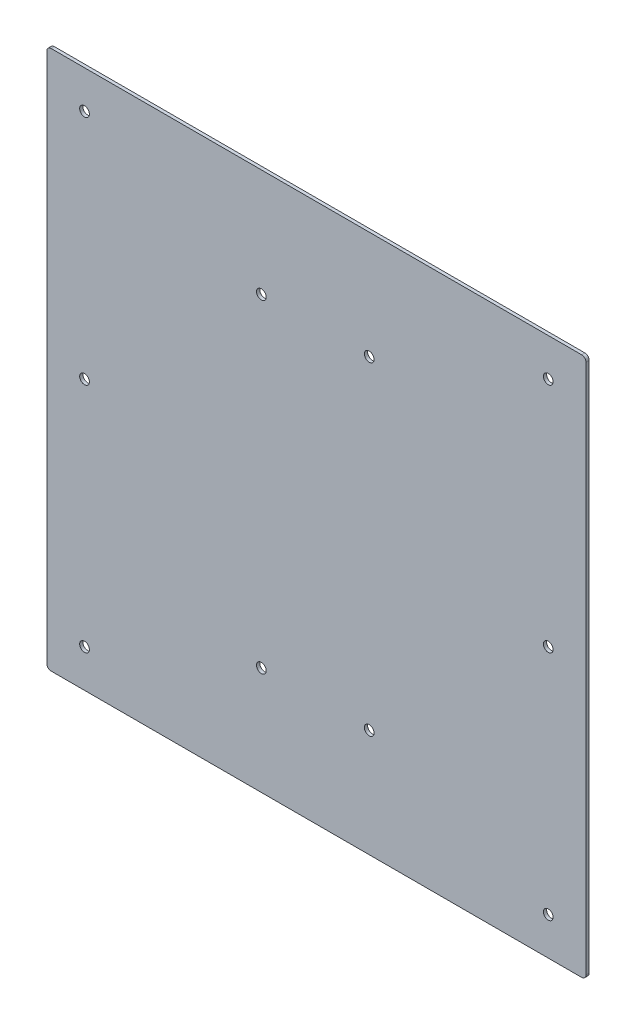
from build123d import *

# Parameters (mm, degrees)
SKETCH1_W           = 250
SKETCH1_H           = 250
SKETCH1_R           = 2.25
BOSS_EXTRUDE1_DEPTH = 1.4986
FILLET1_R           = 2
SKETCH2_R           = 2.25
CUT_EXTRUDE1_DEPTH  = 1.4986


with BuildPart() as part:
    # Sketch1 → Boss-Extrude1 (new body)
    with BuildSketch(Plane.XY):
        Rectangle(SKETCH1_W, SKETCH1_H)
        with Locations(Location((-25.5, 75, 0), (0, 0, 180))):
            Circle(SKETCH1_R, mode=Mode.SUBTRACT)
        with Locations(Location((24.5, 75, 0), (0, 0, 180))):
            Circle(SKETCH1_R, mode=Mode.SUBTRACT)
        with Locations(Location((24.5, -75, 0), (0, 0, 180))):
            Circle(SKETCH1_R, mode=Mode.SUBTRACT)
        with Locations(Location((-25.5, -75, 0), (0, 0, 180))):
            Circle(SKETCH1_R, mode=Mode.SUBTRACT)
    extrude(amount=BOSS_EXTRUDE1_DEPTH)

    # Fillet1
    fillet1_edges = [part.edges().sort_by_distance(p)[0] for p in [
        (125, -125, 0.7493),
        (-125, -125, 0.7493),
        (-125, 125, 0.7493),
        (125, 125, 0.7493),
    ]]
    fillet(fillet1_edges, radius=FILLET1_R)

    # Sketch2 → Cut-Extrude1 (cut)
    with BuildSketch(Plane.XY.offset(1.4986)):
        with Locations((-107.5, 107.5)):
            Circle(SKETCH2_R)
        with Locations((107.5, 107.5)):
            Circle(SKETCH2_R)
        with Locations((107.5, -107.5)):
            Circle(SKETCH2_R)
        with Locations((-107.5, -107.5)):
            Circle(SKETCH2_R)
        with Locations((-107.5, 0)):
            Circle(SKETCH2_R)
        with Locations((107.5, 0)):
            Circle(SKETCH2_R)
    extrude(amount=-CUT_EXTRUDE1_DEPTH, mode=Mode.SUBTRACT)


solid = part.part
